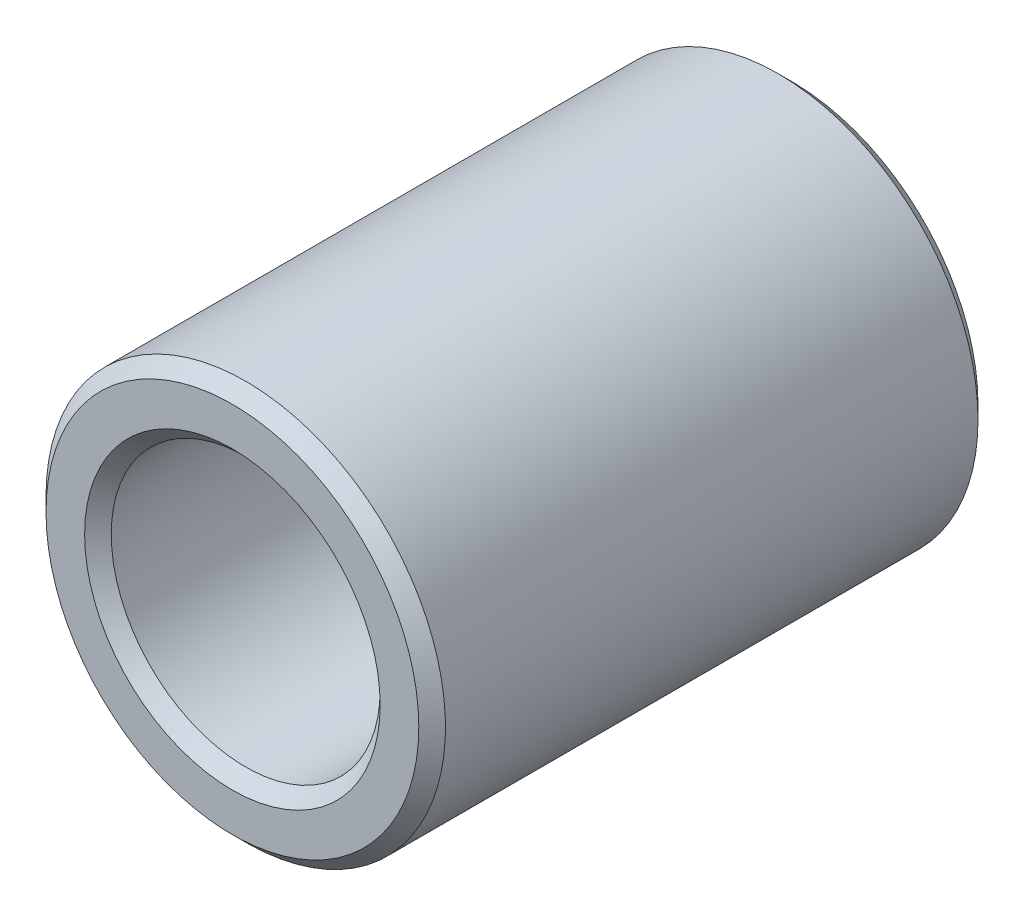
from build123d import *

# Parameters (mm, degrees)
ESBO_O1_R                = 7.5
ESBO_O1_R_2              = 5.05
RESSALTO_EXTRUS_O1_DEPTH = 10.5
CHANFRO1_SIZE            = 0.5


with BuildPart() as part:
    # Esboço1 → Ressalto-extrusão1 (new, symmetric)
    with BuildSketch(Plane.XY):
        with Locations(Location((0, 0, 0), (0, 0, 180))):
            Circle(ESBO_O1_R)
        with Locations(Location((0, 0, 0), (0, 0, 180))):
            Circle(ESBO_O1_R_2, mode=Mode.SUBTRACT)
    extrude(amount=RESSALTO_EXTRUS_O1_DEPTH, both=True)

    # Chanfro1
    chanfro1_edges = [part.edges().sort_by_distance(p)[0] for p in [
        (7.5, 0, -10.5),
        (7.5, 0, 10.5),
        (5.05, 0, -10.5),
        (5.05, 0, 10.5),
    ]]
    chamfer(chanfro1_edges, length=CHANFRO1_SIZE)


solid = part.part
